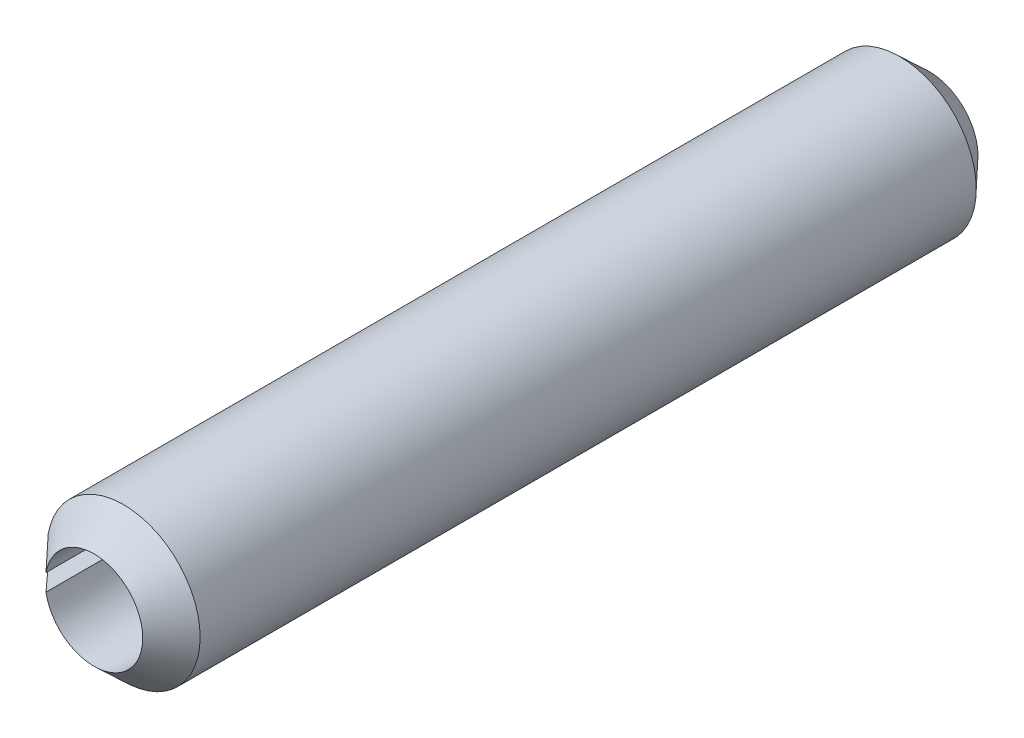
from build123d import *

# Parameters (mm, degrees)
EXTRUDE1_DEPTH = 12


with BuildPart() as part:
    # Sketch1 → Extrude1 (new, symmetric)
    with BuildSketch(Plane.XY):
        with BuildLine():
            Line((-2.166577057, 0.382025991), (-1.378730854, 0.243107449))
            ThreePointArc((-1.378730854, 0.243107449), (1.4, 0), (-1.378730854, -0.243107449))
            Line((-1.378730854, -0.243107449), (-2.166577057, -0.382025991))
            ThreePointArc((-2.166577057, -0.382025991), (2.2, 0), (-2.166577057, 0.382025991))
        make_face()
    extrude(amount=EXTRUDE1_DEPTH, both=True)

    # Sketch2 → Cut-Revolve1 (revolve, cut)
    with BuildSketch(Plane(origin=(0, 0, 0), x_dir=(0, 0, -1), z_dir=(1, 0, 0))):
        Polygon((12, 2.2), (12, 1.4), (11.15, 2.2), align=None)
        Polygon((-11.15, 2.2), (-12, 2.2), (-12, 1.4), align=None)
    revolve(axis=Axis((0, 0, -12), (0, 0, 1)), mode=Mode.SUBTRACT)


solid = part.part
